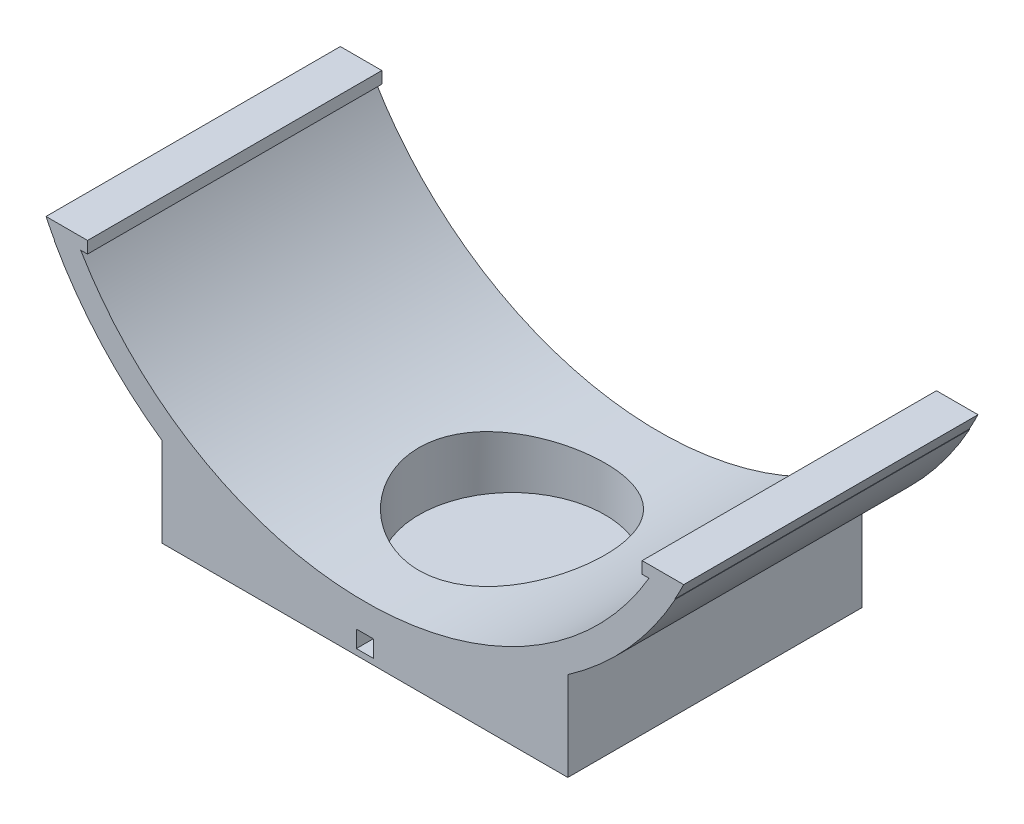
from build123d import *

# Parameters (mm, degrees)
SKETCH_1_R          = 210
SKETCH_1_R_2        = 203
EXTRUDE_2_DEPTH     = 174
EXTRUDE_START       = -174
EXTRUDE_4_DEPTH     = 174
CUT_EXTRUDE_1_DEPTH = 654
EXTRUDE_5_DEPTH     = 174
EXTRUDE_6_DEPTH     = 174
EXTRUDE_7_DEPTH     = 174
EXTRUDE_8_DEPTH     = 174
EXTRUDE_9_DEPTH     = 174
SKETCH_11_R         = 55
CUT_EXTRUDE_4_DEPTH = 221.5
CUT_EXTRUDE_5_DEPTH = 87


with BuildPart() as part:
    # 草图1 → 凸台-拉伸2 (new body)
    with BuildSketch(Plane.XY):
        Circle(SKETCH_1_R)
        Circle(SKETCH_1_R_2, mode=Mode.SUBTRACT)
    extrude(amount=EXTRUDE_2_DEPTH)

    # 草图2 → 凸台-拉伸4 (add)
    with BuildSketch(Plane.XY.offset(174).offset(EXTRUDE_START)):
        with BuildLine():
            Line((-170.735431044, -102), (-173.735431044, -102))
            Line((-173.735431044, -102), (-175.513532242, -102))
            ThreePointArc((-175.513532242, -102), (-174.63092392, -103.50381834), (-173.735431044, -105))
            Line((-173.735431044, -105), (-170.735431044, -105))
            Line((-170.735431044, -105), (-170.735431044, -102))
        make_face()
        with BuildLine():
            ThreePointArc((173.735431044, -105), (174.63092392, -103.50381834), (175.513532242, -102))
            Line((175.513532242, -102), (173.735431044, -102))
            Line((173.735431044, -102), (170.735431044, -102))
            Line((170.735431044, -102), (170.735431044, -105))
            Line((170.735431044, -105), (173.735431044, -105))
        make_face()
    extrude(amount=EXTRUDE_4_DEPTH)

    # 草图3 → 切除-拉伸1 (cut)
    with BuildSketch(Plane.XY.offset(174)):
        Polygon((-170.735431044, -102), (238.333646515, -102), (254.334169784, 272.292523591), (-334.569415043, 221.85110305), (-306.830562533, -102), align=None)
    extrude(amount=-CUT_EXTRUDE_1_DEPTH, mode=Mode.SUBTRACT)

    # 草图5 → 凸台-拉伸5 (add)
    with BuildSketch(Plane.XY.offset(174).offset(EXTRUDE_START)):
        with BuildLine():
            Line((-120, -209.75), (-10.243900624, -209.75))
            ThreePointArc((-10.243900624, -209.75), (-67.755470707, -198.769203322), (-120, -172.336879396))
            Line((-120, -172.336879396), (-120, -209.75))
        make_face()
        with BuildLine():
            ThreePointArc((120, -172.336879396), (67.755470707, -198.769203322), (10.243900624, -209.75))
            Line((10.243900624, -209.75), (120, -209.75))
            Line((120, -209.75), (120, -172.336879396))
        make_face()
    extrude(amount=EXTRUDE_5_DEPTH)

    # 草图6 → 凸台-拉伸6 (add)
    with BuildSketch(Plane.XY.offset(174).offset(EXTRUDE_START)):
        with BuildLine():
            Line((-175.513532242, -102), (-166.195667814, -102))
            ThreePointArc((-166.195667814, -102), (0, -195), (166.195667814, -102))
            Line((166.195667814, -102), (175.513532242, -102))
            ThreePointArc((175.513532242, -102), (0, -203), (-175.513532242, -102))
        make_face()
    extrude(amount=EXTRUDE_6_DEPTH)

    # 草图7 → 凸台-拉伸7 (add)
    with BuildSketch(Plane.XY.offset(174).offset(EXTRUDE_START)):
        with BuildLine():
            Line((-166.933126535, -92), (-166.933126535, -95))
            Line((-166.933126535, -95), (-170.293863659, -95))
            ThreePointArc((-170.293863659, -95), (0, -195), (170.293863659, -95))
            Line((170.293863659, -95), (166.933126535, -95))
            Line((166.933126535, -95), (166.933126535, -92))
            Line((166.933126535, -92), (171.933126535, -92))
            Line((171.933126535, -92), (188.496850106, -92))
            ThreePointArc((188.496850106, -92), (0, -209.75), (-188.496850106, -92))
            Line((-188.496850106, -92), (-171.933126535, -92))
            Line((-171.933126535, -92), (-166.933126535, -92))
        make_face()
    extrude(amount=EXTRUDE_7_DEPTH)

    # 草图8 → 凸台-拉伸8 (add)
    with BuildSketch(Plane(origin=(0, 0, 0), x_dir=(-1, 0, 0), z_dir=(0, 0, -1))):
        with BuildLine():
            Line((166.933126535, -92), (163.933126535, -92))
            Line((163.933126535, -92), (163.933126535, -99))
            Line((163.933126535, -99), (168, -99))
            ThreePointArc((168, -99), (169.158755456, -97.006780447), (170.293863659, -95))
            Line((170.293863659, -95), (166.933126535, -95))
            Line((166.933126535, -95), (166.933126535, -92))
        make_face()
        with BuildLine():
            Line((-166.933126535, -95), (-170.293863659, -95))
            ThreePointArc((-170.293863659, -95), (-169.158755456, -97.006780447), (-168, -99))
            Line((-168, -99), (-163.933126535, -99))
            Line((-163.933126535, -99), (-163.933126535, -92))
            Line((-163.933126535, -92), (-166.933126535, -92))
            Line((-166.933126535, -92), (-166.933126535, -95))
        make_face()
    extrude(amount=-EXTRUDE_8_DEPTH)

    # 草图9 → 凸台-拉伸9 (add)
    with BuildSketch(Plane.XY.offset(174).offset(EXTRUDE_START)):
        with BuildLine():
            ThreePointArc((10.243900624, -209.75), (5.123475383, -209.937490697), (0, -210))
            Line((0, -210), (0, -225))
            Line((0, -225), (18.007375678, -225))
            Line((18.007375678, -225), (120, -225))
            Line((120, -225), (120, -209.75))
            Line((120, -209.75), (10.243900624, -209.75))
        make_face()
        with BuildLine():
            Line((0, -225), (0, -210))
            ThreePointArc((0, -210), (-5.123475383, -209.937490697), (-10.243900624, -209.75))
            Line((-10.243900624, -209.75), (-120, -209.75))
            Line((-120, -209.75), (-120, -225))
            Line((-120, -225), (0, -225))
        make_face()
    extrude(amount=EXTRUDE_9_DEPTH)

    # 草图11 → 切除-拉伸4 (cut)
    with BuildSketch(Plane(origin=(0, 0, 0), x_dir=(1, 0, 0), z_dir=(0, 1, 0))):
        with Locations(Location((0, -87, 0), (0, 0, 270))):
            Circle(SKETCH_11_R)
    extrude(amount=-CUT_EXTRUDE_4_DEPTH, mode=Mode.SUBTRACT)

    # 草图10 → 切除-拉伸5 (cut)
    with BuildSketch(Plane.XY.offset(174)):
        Polygon((5, -221.5), (-5, -221.5), (-5, -211.5), (0, -211.5), (5, -211.5), align=None)
    extrude(amount=-CUT_EXTRUDE_5_DEPTH, mode=Mode.SUBTRACT)


solid = part.part
